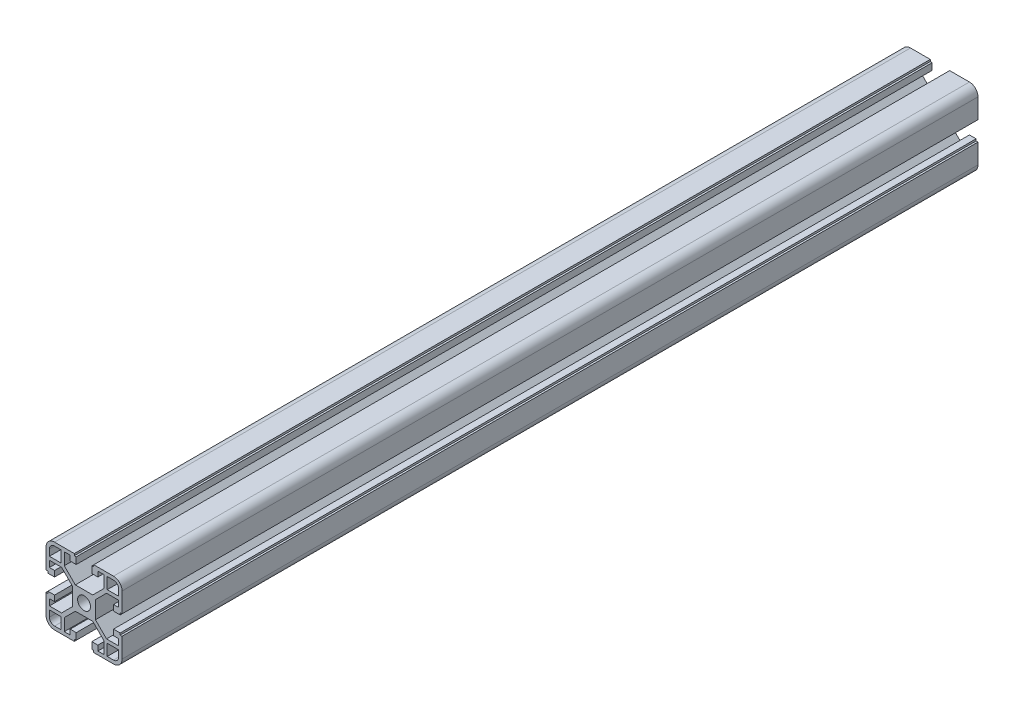
from build123d import *

# Parameters (mm, degrees)
SKETCH3_R           = 3.4
BOSS_EXTRUDE1_DEPTH = 450


with BuildPart() as part:
    # Sketch3 → Boss-Extrude1 (new body)
    with BuildSketch(Plane.XY):
        with BuildLine():
            Line((-11.814213562, 10.4), (-6, 4.585786438))
            Line((-6, 4.585786438), (-6, -4.585786438))
            Line((-6, -4.585786438), (-11.814213562, -10.4))
            Line((-11.814213562, -10.4), (-18.2, -10.4))
            Line((-18.2, -10.4), (-18.2, -7.1))
            Line((-18.2, -7.1), (-15.5, -7.1))
            Line((-15.5, -7.1), (-15.5, -4.1))
            Line((-15.5, -4.1), (-19, -4.1))
            Line((-19, -4.1), (-19, -5.1))
            Line((-19, -5.1), (-20, -5.1))
            Line((-20, -5.1), (-20, -15.5))
            ThreePointArc((-20, -15.5), (-18.681980515, -18.681980515), (-15.5, -20))
            Line((-15.5, -20), (-5.1, -20))
            Line((-5.1, -20), (-5.1, -19))
            Line((-5.1, -19), (-4.1, -19))
            Line((-4.1, -19), (-4.1, -15.5))
            Line((-4.1, -15.5), (-7.258114106, -15.5))
            Line((-7.258114106, -15.5), (-7.258114106, -18.2))
            Line((-7.258114106, -18.2), (-10.4, -18.2))
            Line((-10.4, -18.2), (-10.4, -11.814213562))
            Line((-10.4, -11.814213562), (-4.585786438, -6))
            Line((-4.585786438, -6), (4.585786438, -6))
            Line((4.585786438, -6), (10.4, -11.814213562))
            Line((10.4, -11.814213562), (10.4, -18.2))
            Line((10.4, -18.2), (7.258114106, -18.2))
            Line((7.258114106, -18.2), (7.258114106, -15.5))
            Line((7.258114106, -15.5), (4.1, -15.5))
            Line((4.1, -15.5), (4.1, -19))
            Line((4.1, -19), (5.1, -19))
            Line((5.1, -19), (5.1, -20))
            Line((5.1, -20), (15.5, -20))
            ThreePointArc((15.5, -20), (18.681980515, -18.681980515), (20, -15.5))
            Line((20, -15.5), (20, -5.1))
            Line((20, -5.1), (19, -5.1))
            Line((19, -5.1), (19, -4.1))
            Line((19, -4.1), (15.5, -4.1))
            Line((15.5, -4.1), (15.5, -7.1))
            Line((15.5, -7.1), (18.2, -7.1))
            Line((18.2, -7.1), (18.2, -10.4))
            Line((18.2, -10.4), (11.814213562, -10.4))
            Line((11.814213562, -10.4), (6, -4.585786438))
            Line((6, -4.585786438), (6, 4.585786438))
            Line((6, 4.585786438), (11.814213562, 10.4))
            Line((11.814213562, 10.4), (18.2, 10.4))
            Line((18.2, 10.4), (18.2, 7.1))
            Line((18.2, 7.1), (15.5, 7.1))
            Line((15.5, 7.1), (15.5, 4.1))
            Line((15.5, 4.1), (19, 4.1))
            Line((19, 4.1), (19, 5.1))
            Line((19, 5.1), (20, 5.1))
            Line((20, 5.1), (20, 15.5))
            ThreePointArc((20, 15.5), (18.681980515, 18.681980515), (15.5, 20))
            Line((15.5, 20), (5.1, 20))
            Line((5.1, 20), (5.1, 19))
            Line((5.1, 19), (4.1, 19))
            Line((4.1, 19), (4.1, 15.5))
            Line((4.1, 15.5), (7.258114106, 15.5))
            Line((7.258114106, 15.5), (7.258114106, 18.2))
            Line((7.258114106, 18.2), (10.4, 18.2))
            Line((10.4, 18.2), (10.4, 11.814213562))
            Line((10.4, 11.814213562), (4.585786438, 6))
            Line((4.585786438, 6), (-4.585786438, 6))
            Line((-4.585786438, 6), (-10.4, 11.814213562))
            Line((-10.4, 11.814213562), (-10.4, 18.2))
            Line((-10.4, 18.2), (-7.258114106, 18.2))
            Line((-7.258114106, 18.2), (-7.258114106, 15.5))
            Line((-7.258114106, 15.5), (-4.1, 15.5))
            Line((-4.1, 15.5), (-4.1, 19))
            Line((-4.1, 19), (-5.1, 19))
            Line((-5.1, 19), (-5.1, 20))
            Line((-5.1, 20), (-15.5, 20))
            ThreePointArc((-15.5, 20), (-18.681980515, 18.681980515), (-20, 15.5))
            Line((-20, 15.5), (-20, 5.1))
            Line((-20, 5.1), (-19, 5.1))
            Line((-19, 5.1), (-19, 4.1))
            Line((-19, 4.1), (-15.5, 4.1))
            Line((-15.5, 4.1), (-15.5, 7.1))
            Line((-15.5, 7.1), (-18.2, 7.1))
            Line((-18.2, 7.1), (-18.2, 10.4))
            Line((-18.2, 10.4), (-11.814213562, 10.4))
        make_face()
        with BuildLine():
            Line((-18.2, -15.5), (-18.2, -12.2))
            Line((-18.2, -12.2), (-12.2, -12.2))
            Line((-12.2, -12.2), (-12.2, -18.2))
            Line((-12.2, -18.2), (-15.5, -18.2))
            ThreePointArc((-15.5, -18.2), (-17.409188309, -17.409188309), (-18.2, -15.5))
        make_face(mode=Mode.SUBTRACT)
        Circle(SKETCH3_R, mode=Mode.SUBTRACT)
        with BuildLine():
            Line((-18.2, 12.2), (-18.2, 15.5))
            ThreePointArc((-18.2, 15.5), (-17.409188309, 17.409188309), (-15.5, 18.2))
            Line((-15.5, 18.2), (-12.2, 18.2))
            Line((-12.2, 18.2), (-12.2, 12.2))
            Line((-12.2, 12.2), (-18.2, 12.2))
        make_face(mode=Mode.SUBTRACT)
        with BuildLine():
            Line((18.2, 15.5), (18.2, 12.2))
            Line((18.2, 12.2), (12.2, 12.2))
            Line((12.2, 12.2), (12.2, 18.2))
            Line((12.2, 18.2), (15.5, 18.2))
            ThreePointArc((15.5, 18.2), (17.409188309, 17.409188309), (18.2, 15.5))
        make_face(mode=Mode.SUBTRACT)
        with BuildLine():
            Line((12.2, -18.2), (12.2, -12.2))
            Line((12.2, -12.2), (18.2, -12.2))
            Line((18.2, -12.2), (18.2, -15.5))
            ThreePointArc((18.2, -15.5), (17.409188309, -17.409188309), (15.5, -18.2))
            Line((15.5, -18.2), (12.2, -18.2))
        make_face(mode=Mode.SUBTRACT)
    extrude(amount=BOSS_EXTRUDE1_DEPTH)


solid = part.part
